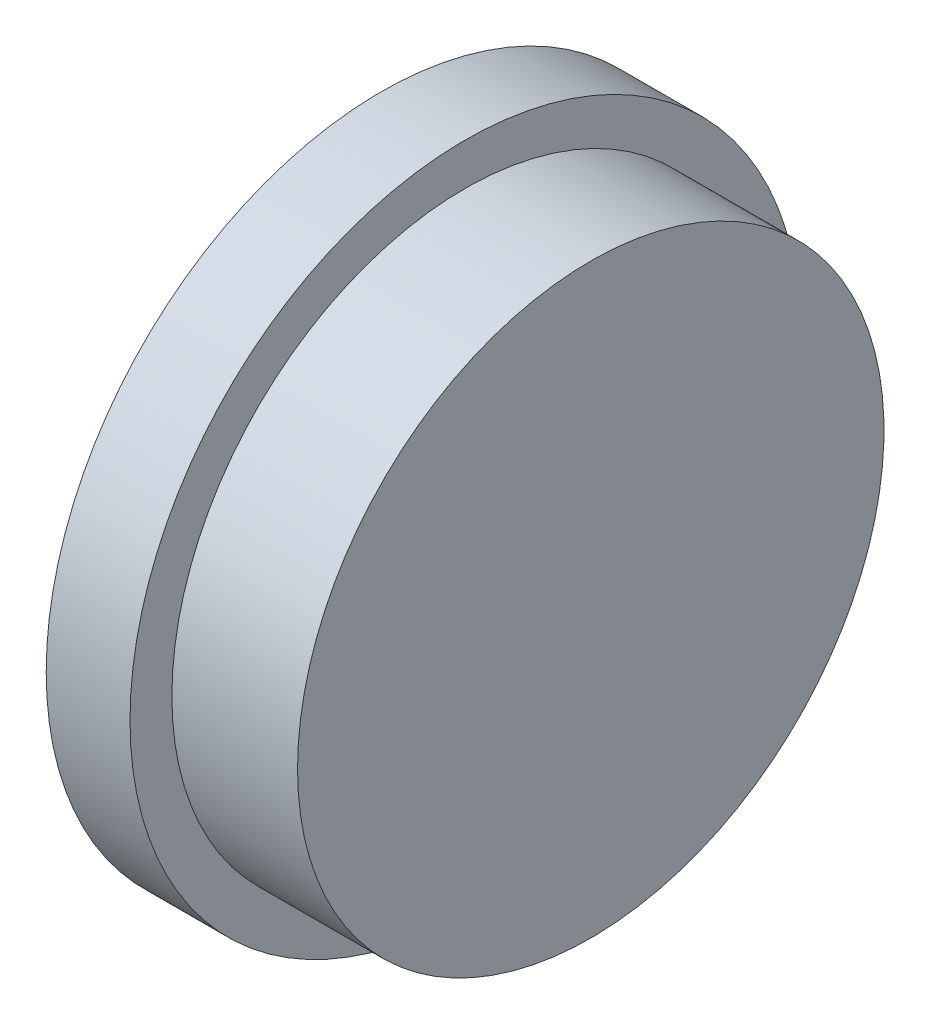
from build123d import *


with BuildPart() as part:
    # Esquisse1 → Révolution1 (revolve)
    with BuildSketch(Plane.XY, mode=Mode.PRIVATE) as r_volution1_sk:
        Polygon((150, 0), (150, 210), (60, 210), (60, 240), (0, 240), (0, 160), (130, 160), (130, 0), align=None)
    revolve(r_volution1_sk.sketch.rotate(Axis((0, 0, 0), (1, 0, 0)), 90), axis=Axis((0, 0, 0), (1, 0, 0)))


solid = part.part
